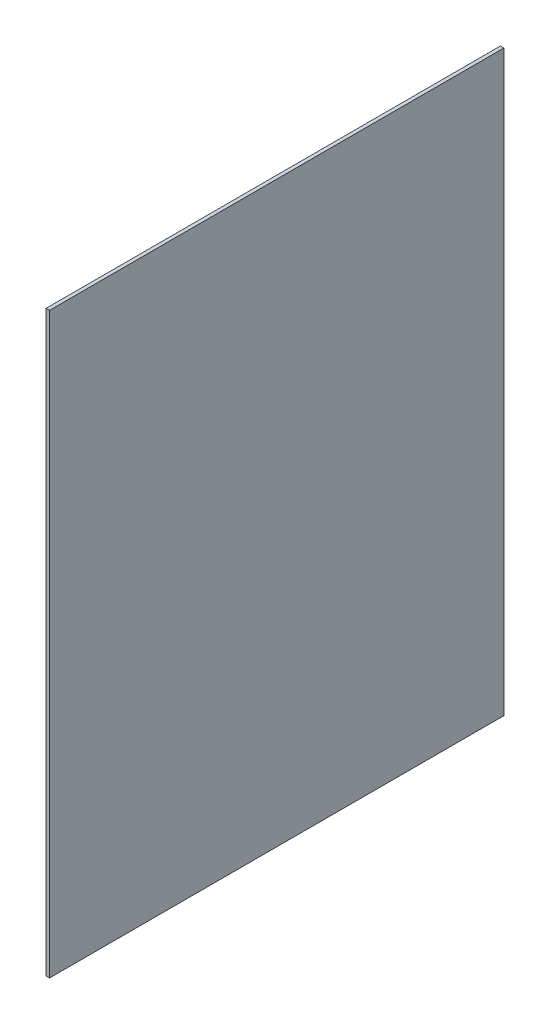
from build123d import *

# Parameters (mm, degrees)
SKETCH1_W           = 1676.4
SKETCH1_H           = 2133.6
BOSS_EXTRUDE1_DEPTH = 12.7


with BuildPart() as part:
    # Sketch1 → Boss-Extrude1 (new body)
    with BuildSketch(Plane(origin=(0, 0, 0), x_dir=(0, 0, -1), z_dir=(1, 0, 0))):
        with Locations((838.2, 1066.8)):
            Rectangle(SKETCH1_W, SKETCH1_H)
    extrude(amount=BOSS_EXTRUDE1_DEPTH)


solid = part.part
